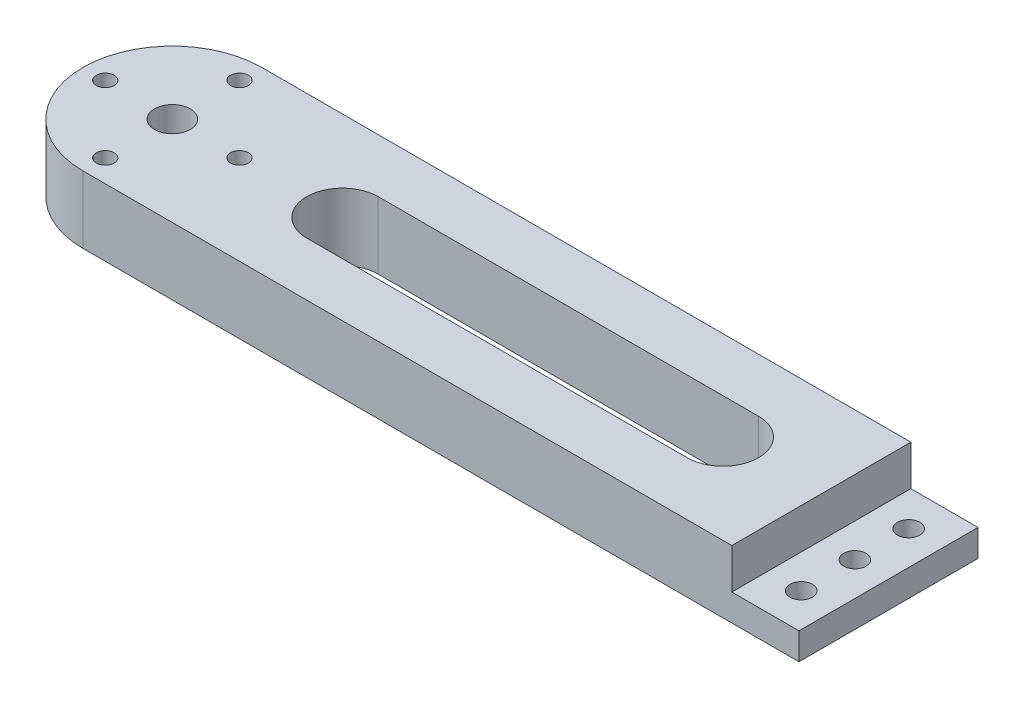
from build123d import *

# Parameters (mm, degrees)
SKETCH_1_R            = 2
SKETCH_1_R_2          = 4
EXTRUDE_1_DEPTH       = 15
CUT_EXTRUDE_1_REACH   = 167.605
SKETCH_2_W            = 15
SKETCH_2_H            = 9
HOLE_WIZARD_5_0_5_1_D = 5
CUT_EXTRUDE_2_REACH   = 163.941


with BuildPart() as part:
    # 草图1 → 凸台-拉伸1 (new body)
    with BuildSketch(Plane(origin=(0, 0, 0), x_dir=(1, 0, 0), z_dir=(0, 1, 0))):
        with BuildLine():
            Line((0, 20), (160, 20))
            Line((160, 20), (160, -20))
            Line((160, -20), (0, -20))
            ThreePointArc((0, -20), (-20, 0), (0, 20))
        make_face()
        with Locations(Location((0, 15, 0), (0, 0, 270))):
            Circle(SKETCH_1_R, mode=Mode.SUBTRACT)
        with Locations(Location((15, 0, 0), (0, 0, 270))):
            Circle(SKETCH_1_R, mode=Mode.SUBTRACT)
        with Locations(Location((0, -15, 0), (0, 0, 270))):
            Circle(SKETCH_1_R, mode=Mode.SUBTRACT)
        with Locations(Location((-15, 0, 0), (0, 0, 270))):
            Circle(SKETCH_1_R, mode=Mode.SUBTRACT)
        with Locations(Location((0, 0, 0), (0, 0, 270))):
            Circle(SKETCH_1_R_2, mode=Mode.SUBTRACT)
    extrude(amount=EXTRUDE_1_DEPTH)

    # 草图2 → 切除-拉伸1 (cut, up to next)
    with BuildSketch(Plane.XY.offset(20), mode=Mode.PRIVATE) as cut_extrude_1_sk1:
        with Locations((152.5, 10.5)):
            Rectangle(SKETCH_2_W, SKETCH_2_H)
    cut_extrude_1_tool1 = extrude(cut_extrude_1_sk1.sketch, amount=-CUT_EXTRUDE_1_REACH, mode=Mode.PRIVATE) & part.part
    add(cut_extrude_1_tool1.solids().sort_by_distance((152.5, 10.5, 20))[0], mode=Mode.SUBTRACT)

    # Ø5.0 (5) 直径孔1 (through all)
    with Locations(Plane(origin=(0, 0, 0), x_dir=(-1, 0, 0), z_dir=(0, -1, 0))):
        with Locations((-152.5, -12), (-152.5, 0), (-152.5, 12)):
            Hole(HOLE_WIZARD_5_0_5_1_D / 2)

    # 草图6 → 切除-拉伸2 (cut, up to next)
    with BuildSketch(Plane(origin=(0, 0, 0), x_dir=(1, 0, 0), z_dir=(0, 1, 0)), mode=Mode.PRIVATE) as cut_extrude_2_sk1:
        with BuildLine():
            Line((38, -8), (123, -8))
            ThreePointArc((123, -8), (131, 0), (123, 8))
            Line((123, 8), (38, 8))
            ThreePointArc((38, 8), (30, 0), (38, -8))
        make_face()
    cut_extrude_2_tool1 = extrude(cut_extrude_2_sk1.sketch, amount=CUT_EXTRUDE_2_REACH, mode=Mode.PRIVATE) & part.part
    add(cut_extrude_2_tool1.solids().sort_by_distance((80.5, 0, 0))[0], mode=Mode.SUBTRACT)


solid = part.part
